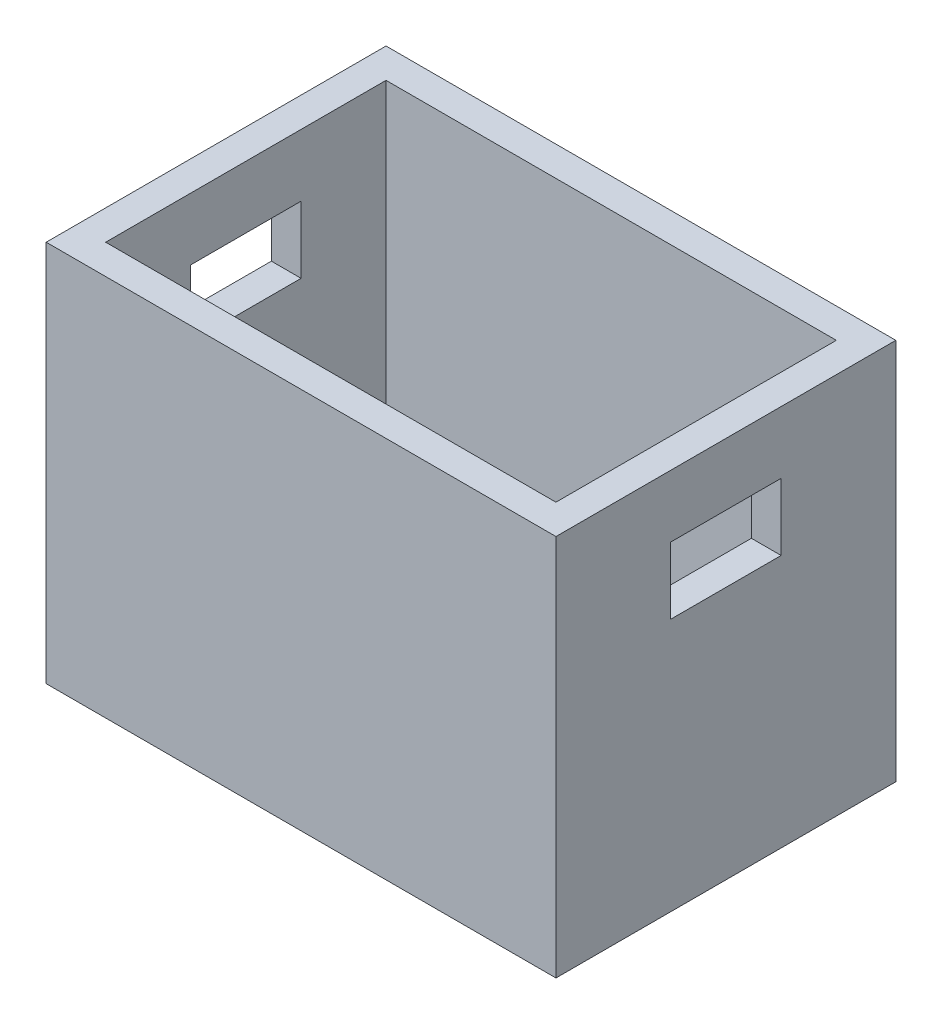
from build123d import *

# Parameters (mm, degrees)
SKETCH1_W           = 60
SKETCH1_H           = 40
BOSS_EXTRUDE1_DEPTH = 45
SHELL1_T            = -3.5
SKETCH2_W           = 13.00777657
SKETCH2_H           = 7.86625136
CUT_EXTRUDE1_DEPTH  = 78.620873481


with BuildPart() as part:
    # Sketch1 → Boss-Extrude1 (new body)
    with BuildSketch(Plane(origin=(0, 0, 0), x_dir=(1, 0, 0), z_dir=(0, 1, 0))):
        Rectangle(SKETCH1_W, SKETCH1_H)
    extrude(amount=BOSS_EXTRUDE1_DEPTH)

    # Shell1
    shell1_openings = [part.faces().sort_by_distance(p)[0] for p in [
        (0, 45, 0),
    ]]
    offset(amount=SHELL1_T, openings=shell1_openings, kind=Kind.INTERSECTION)

    # Sketch2 → Cut-Extrude1 (cut, through all)
    with BuildSketch(Plane(origin=(30, 0, 0), x_dir=(0, 0, -1), z_dir=(1, 0, 0))):
        with Locations((0, 33.75)):
            Rectangle(SKETCH2_W, SKETCH2_H)
    extrude(amount=-CUT_EXTRUDE1_DEPTH, mode=Mode.SUBTRACT)


solid = part.part
